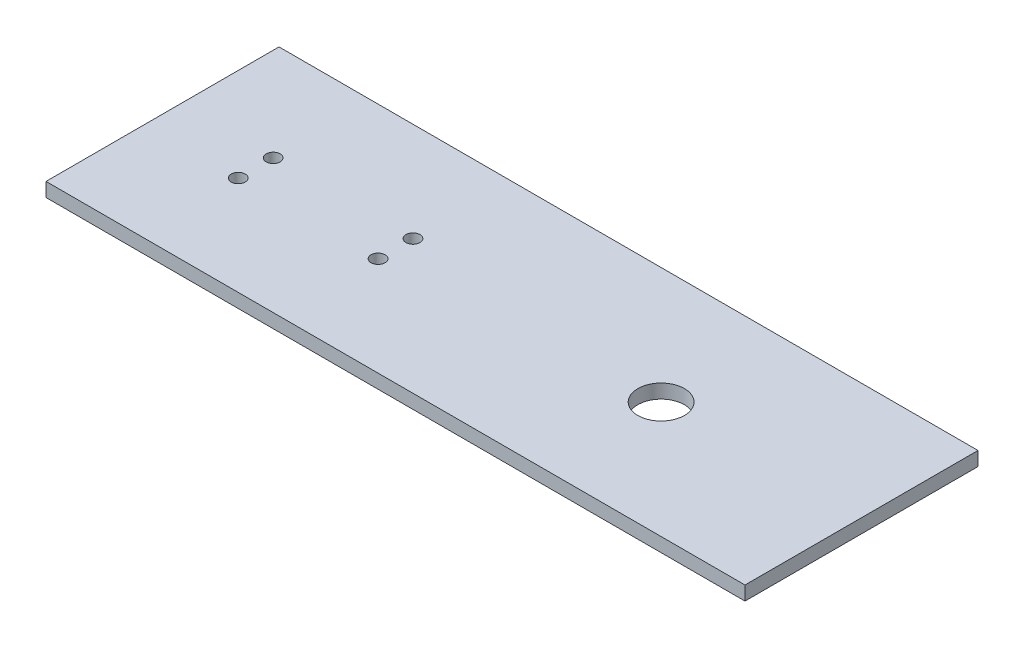
from build123d import *

# Parameters (mm, degrees)
SKETCH1_W               = 150
SKETCH1_H               = 50
BOSS_EXTRUDE1_DEPTH     = 3
CUT_EXTRUDE1_DEPTH      = 80.113842025
CUT_EXTRUDE1_DEPTH_BACK = 80.113842025
SKETCH2_R               = 1.5
SKETCH3_R               = 5
CUT_EXTRUDE2_DEPTH      = 80.113842025


with BuildPart() as part:
    # Sketch1 → Boss-Extrude1 (new body)
    with BuildSketch(Plane(origin=(0, 0, 0), x_dir=(1, 0, 0), z_dir=(0, 1, 0))):
        Rectangle(SKETCH1_W, SKETCH1_H)
    extrude(amount=BOSS_EXTRUDE1_DEPTH)

    # Sketch2 → Cut-Extrude1 (cut, two sides: drawn at the far end of the back side and taken through both)
    with BuildSketch(Plane(origin=(0, 3, 0), x_dir=(1, 0, 0), z_dir=(0, 1, 0)).offset(-CUT_EXTRUDE1_DEPTH_BACK)):
        with Locations(Location((-55, 3.75, 0), (0, 0, 270))):
            Circle(SKETCH2_R)
        with Locations(Location((-55, -3.75, 0), (0, 0, 90))):
            Circle(SKETCH2_R)
        with Locations(Location((-25, -3.75, 0), (0, 0, 270))):
            Circle(SKETCH2_R)
        with Locations(Location((-25, 3.75, 0), (0, 0, 90))):
            Circle(SKETCH2_R)
    extrude(amount=CUT_EXTRUDE1_DEPTH + CUT_EXTRUDE1_DEPTH_BACK, mode=Mode.SUBTRACT)

    # Sketch3 → Cut-Extrude2 (cut, through all)
    with BuildSketch(Plane(origin=(0, 3, 0), x_dir=(1, 0, 0), z_dir=(0, 1, 0))):
        with Locations(Location((32, 0, 0), (0, 0, 270))):
            Circle(SKETCH3_R)
    extrude(amount=-CUT_EXTRUDE2_DEPTH, mode=Mode.SUBTRACT)


solid = part.part
